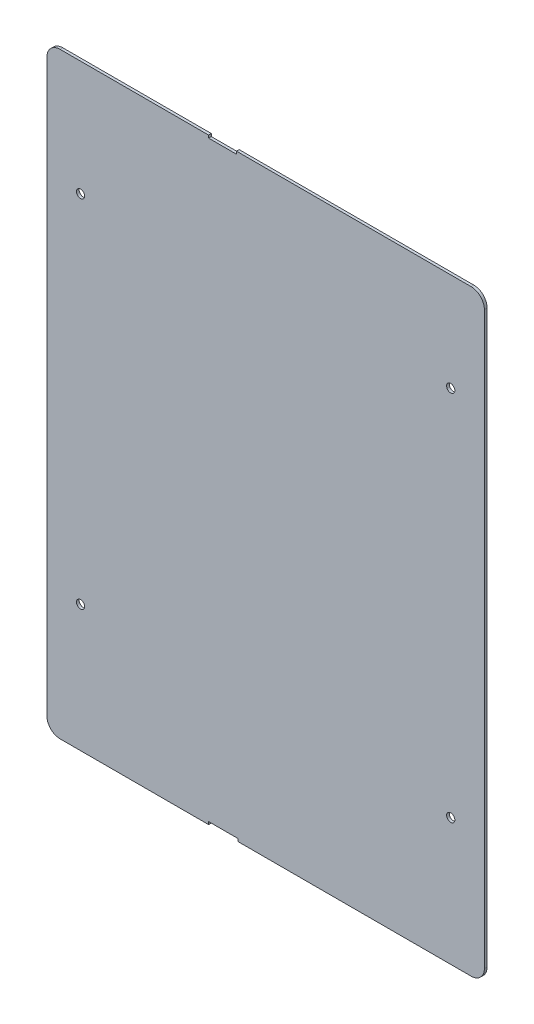
from build123d import *

# Parameters (mm, degrees)
BOSS_EXTRUDE1_DEPTH     = 2.032
CUT_EXTRUDE5_DEPTH      = 280.217095866
CUT_EXTRUDE5_DEPTH_BACK = 280.217095866
SKETCH7_R               = 3.1
FILLET4_R               = 10


with BuildPart() as part:
    # Sketch2 → Boss-Extrude1 (new body)
    with BuildSketch(Plane.XY):
        Polygon((-43, 225.24), (-43, 223.24), (-22, 223.24), (-22, 225.24), (165, 225.24), (165, -225.24), (-21, -225.24), (-21, -223.24), (-43, -223.24), (-43, -225.24), (-165, -225.24), (-165, 225.24), align=None)
    extrude(amount=BOSS_EXTRUDE1_DEPTH)

    # Sketch7 → Cut-Extrude5 (cut, two sides: drawn at the far end of the back side and taken through both)
    with BuildSketch(Plane.XY.offset(2.032).offset(-CUT_EXTRUDE5_DEPTH_BACK)):
        with Locations((-139.599996944, -129.61479672)):
            Circle(SKETCH7_R)
        with Locations((-139.599996944, 138.555201517)):
            Circle(SKETCH7_R)
        with Locations((139.600003056, 151.166005167)):
            Circle(SKETCH7_R)
        with Locations((139.600003056, -129.360049889)):
            Circle(SKETCH7_R)
    extrude(amount=CUT_EXTRUDE5_DEPTH + CUT_EXTRUDE5_DEPTH_BACK, mode=Mode.SUBTRACT)

    # Fillet4
    fillet4_edges = [part.edges().sort_by_distance(p)[0] for p in [
        (-165, -225.24, 1.016),
        (-165, 225.24, 1.016),
        (165, 225.24, 1.016),
        (165, -225.24, 1.016),
    ]]
    fillet(fillet4_edges, radius=FILLET4_R)


solid = part.part
